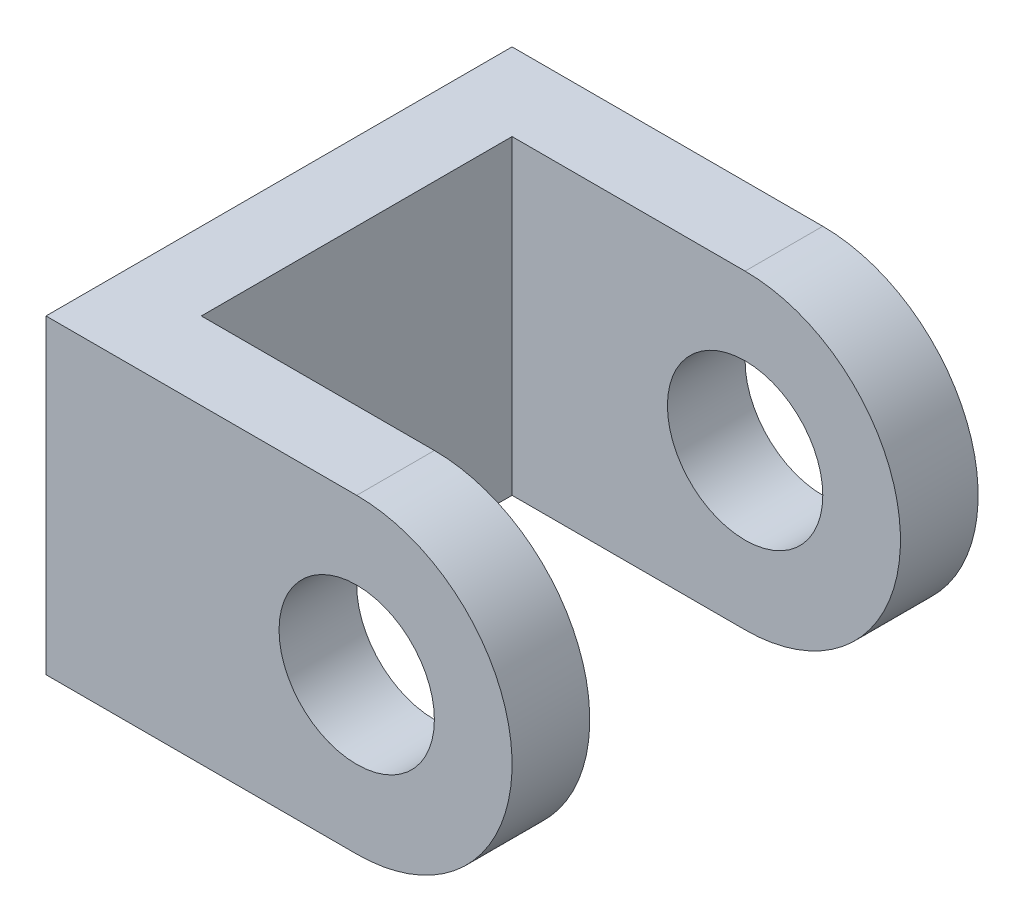
from build123d import *

# Parameters (mm, degrees)
SKETCH1_R           = 5
BOSS_EXTRUDE1_DEPTH = 30
SKETCH2_W           = 20
SKETCH2_H           = 20
CUT_EXTRUDE1_DEPTH  = 25


with BuildPart() as part:
    # Sketch1 → Boss-Extrude1 (new body)
    with BuildSketch(Plane.XY):
        with BuildLine():
            Line((-10, 10), (10, 10))
            ThreePointArc((10, 10), (20, 0), (10, -10))
            Line((10, -10), (-10, -10))
            Line((-10, -10), (-10, 10))
        make_face()
        with Locations((10, 0)):
            Circle(SKETCH1_R, mode=Mode.SUBTRACT)
    extrude(amount=-BOSS_EXTRUDE1_DEPTH)

    # Sketch2 → Cut-Extrude1 (cut)
    with BuildSketch(Plane(origin=(20, 0, 0), x_dir=(0, 0, -1), z_dir=(1, 0, 0))):
        with Locations((15, 0)):
            Rectangle(SKETCH2_W, SKETCH2_H)
    extrude(amount=-CUT_EXTRUDE1_DEPTH, mode=Mode.SUBTRACT)


solid = part.part
